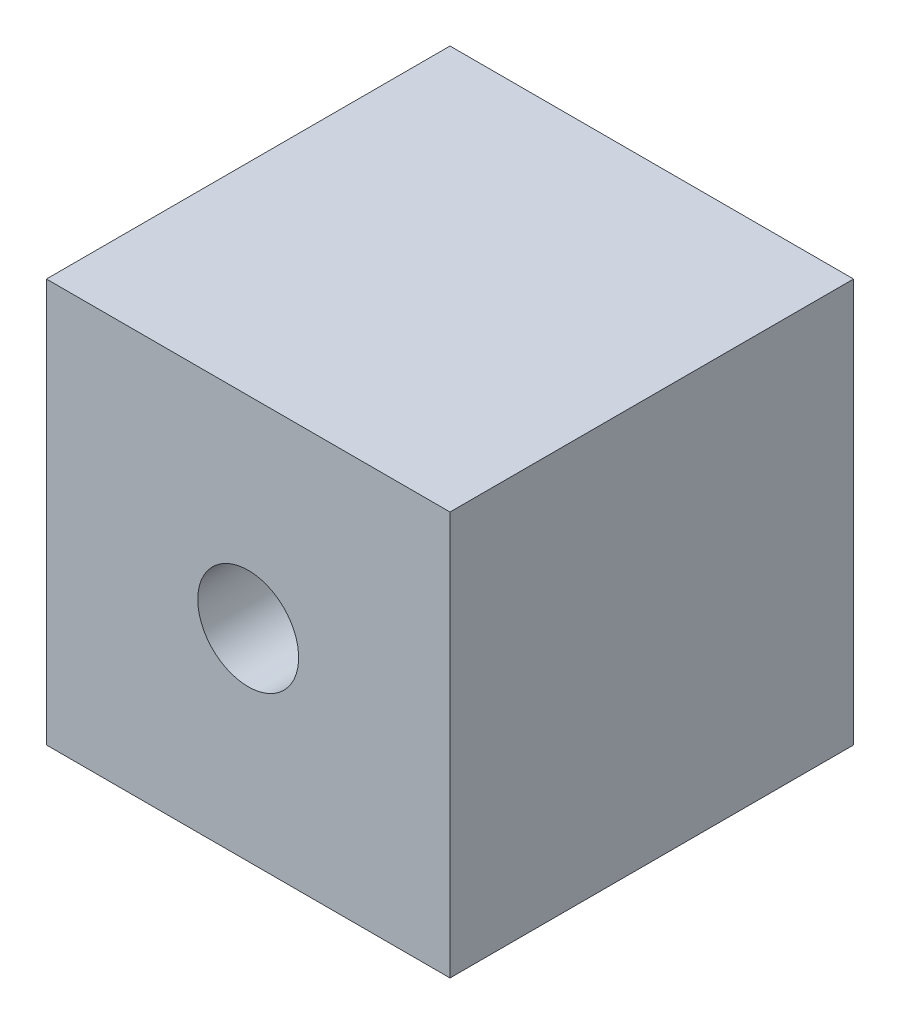
from build123d import *

# Parameters (mm, degrees)
SKETCH_1_W          = 60
SKETCH_1_H          = 60
EXTRUDE_1_DEPTH     = 30
SKETCH_2_R          = 7.5
CUT_EXTRUDE_1_DEPTH = 74.484692283


with BuildPart() as part:
    # 草图1 → 凸台-拉伸1 (new, symmetric)
    with BuildSketch(Plane.XY):
        Rectangle(SKETCH_1_W, SKETCH_1_H)
    extrude(amount=EXTRUDE_1_DEPTH, both=True)

    # 草图2 → 切除-拉伸1 (cut, through all)
    with BuildSketch(Plane(origin=(0, 0, 30), x_dir=(-1, 0, 0), z_dir=(0, 0, -1))):
        Circle(SKETCH_2_R)
    extrude(amount=CUT_EXTRUDE_1_DEPTH, mode=Mode.SUBTRACT)


solid = part.part
